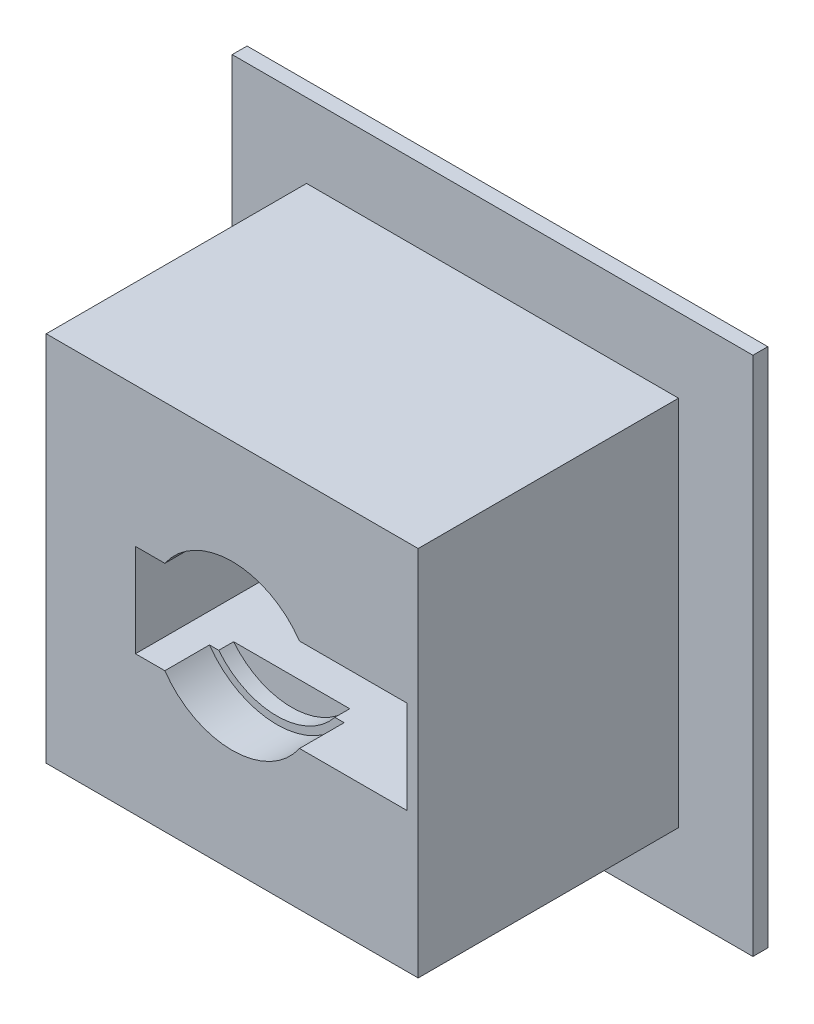
from build123d import *

# Parameters (mm, degrees)
SKETCH1_W           = 70
SKETCH1_H           = 70
BOSS_EXTRUDE1_DEPTH = 2
SKETCH2_W           = 50
SKETCH2_H           = 50
BOSS_EXTRUDE2_DEPTH = 35
SKETCH3_R           = 11
CUT_EXTRUDE1_DEPTH  = 6
SKETCH4_R           = 10
CUT_EXTRUDE2_DEPTH  = 2
SKETCH5_W           = 26.5
SKETCH5_H           = 12.5
CUT_EXTRUDE3_DEPTH  = 106.683489723
SKETCH7_W           = 5
SKETCH7_H           = 5.02305645
CUT_EXTRUDE4_DEPTH  = 96.557574268
SKETCH8_W           = 5
SKETCH8_H           = 12.5
CUT_EXTRUDE5_DEPTH  = 18


with BuildPart() as part:
    # Sketch1 → Boss-Extrude1 (new body)
    with BuildSketch(Plane.XY):
        with Locations((35, -35)):
            Rectangle(SKETCH1_W, SKETCH1_H)
    extrude(amount=BOSS_EXTRUDE1_DEPTH)

    # Sketch2 → Boss-Extrude2 (add)
    with BuildSketch(Plane.XY.offset(2)):
        with Locations((35, -35)):
            Rectangle(SKETCH2_W, SKETCH2_H)
    extrude(amount=BOSS_EXTRUDE2_DEPTH)

    # Sketch3 → Cut-Extrude1 (cut)
    with BuildSketch(Plane.XY.offset(37)):
        with Locations((35, -35)):
            Circle(SKETCH3_R)
    extrude(amount=-CUT_EXTRUDE1_DEPTH, mode=Mode.SUBTRACT)

    # Sketch4 → Cut-Extrude2 (cut)
    with BuildSketch(Plane.XY.offset(31)):
        with Locations((35, -35)):
            Circle(SKETCH4_R)
    extrude(amount=-CUT_EXTRUDE2_DEPTH, mode=Mode.SUBTRACT)

    # Sketch5 → Cut-Extrude3 (cut, through all)
    with BuildSketch(Plane.XY.offset(37)):
        with Locations((40.25, -35)):
            Rectangle(SKETCH5_W, SKETCH5_H)
    extrude(amount=-CUT_EXTRUDE3_DEPTH, mode=Mode.SUBTRACT)

    # Sketch7 → Cut-Extrude4 (cut, through all)
    with BuildSketch(Plane.ZY.offset(-53.5)):
        with Locations((2.5, -35)):
            Rectangle(SKETCH7_W, SKETCH7_H)
    extrude(amount=CUT_EXTRUDE4_DEPTH, mode=Mode.SUBTRACT)

    # Sketch8 → Cut-Extrude5 (cut)
    with BuildSketch(Plane.XY.offset(37)):
        with Locations((56, -35)):
            Rectangle(SKETCH8_W, SKETCH8_H)
        with Locations((24.5, -35)):
            Rectangle(SKETCH8_W, SKETCH8_H)
    extrude(amount=-CUT_EXTRUDE5_DEPTH, mode=Mode.SUBTRACT)


solid = part.part
